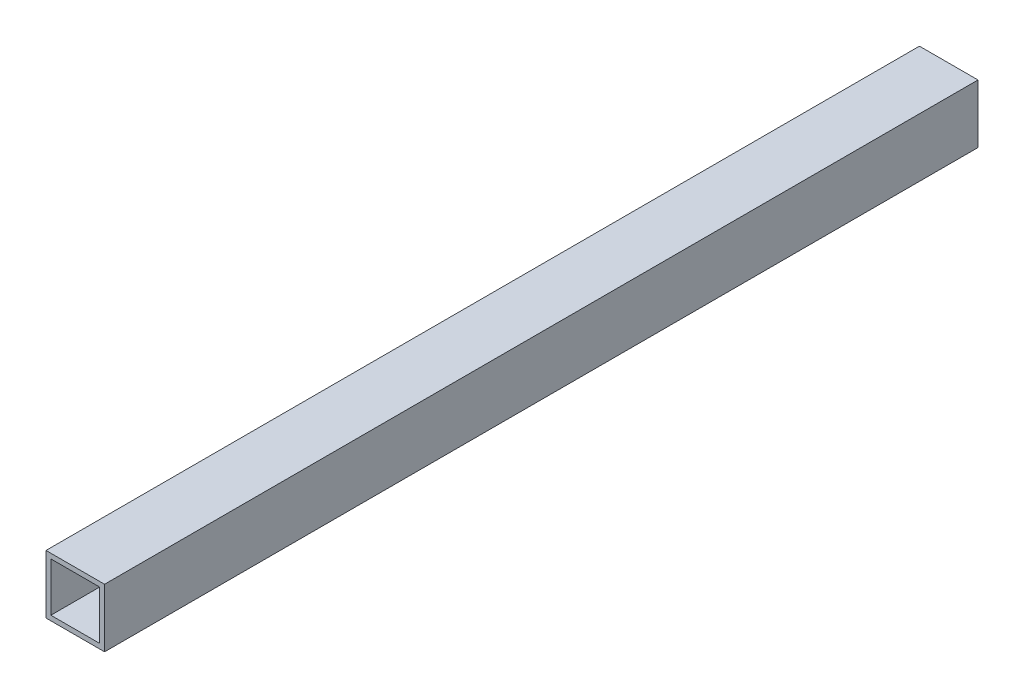
from build123d import *

# Parameters (mm, degrees)
SKETCH_1_W      = 24
SKETCH_1_H      = 24
SKETCH_1_W_2    = 20
SKETCH_1_H_2    = 20
EXTRUDE_1_DEPTH = 358


with BuildPart() as part:
    # 草图1 → 凸台-拉伸1 (new body)
    with BuildSketch(Plane.XY):
        Rectangle(SKETCH_1_W, SKETCH_1_H)
        Rectangle(SKETCH_1_W_2, SKETCH_1_H_2, mode=Mode.SUBTRACT)
    extrude(amount=EXTRUDE_1_DEPTH)


solid = part.part
